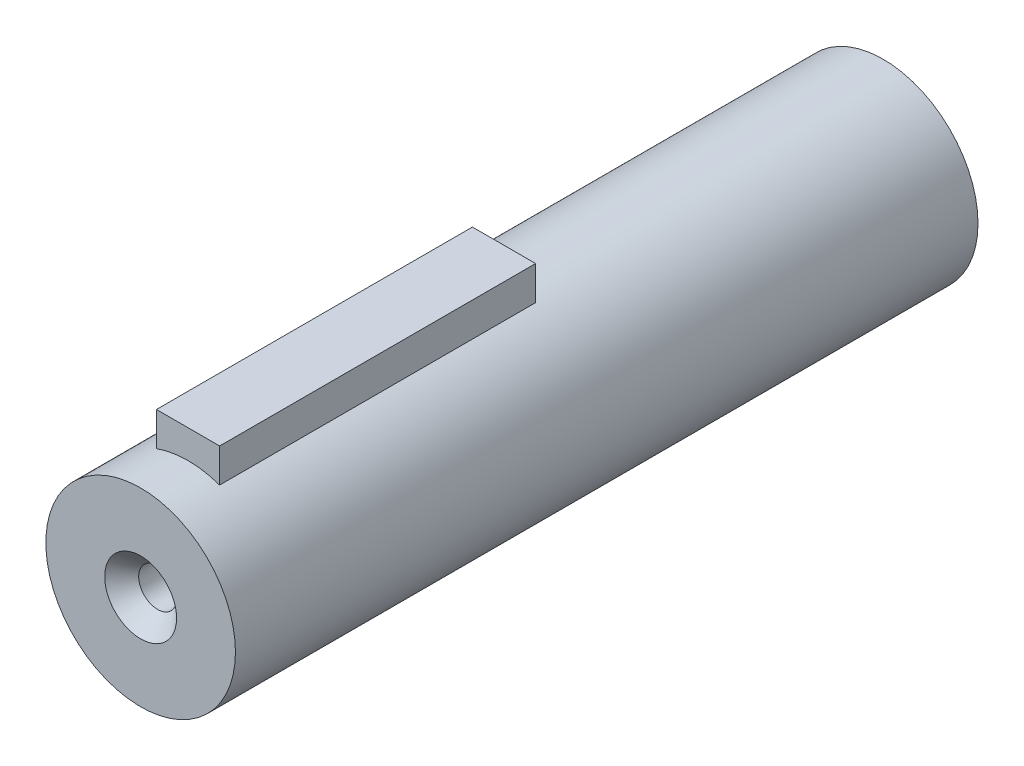
from build123d import *

# Parameters (mm, degrees)
SKETCH_1_R                   = 6
EXTRUDE_1_DEPTH              = 47
EXTRUDE_2_DEPTH              = 1.8
EXTRUDE_2_DEPTH_BACK         = 1.8
SKETCH_2_W                   = 20
SKETCH_2_H                   = 4
HOLE_WIZARD_M2_2_D           = 2.4
HOLE_WIZARD_M2_2_DEPTH       = 5
HOLE_WIZARD_M2_2_CSINK_D     = 4.55
HOLE_WIZARD_M2_2_CSINK_ANGLE = 90
HOLE_WIZARD_M2_2_TIP         = 0.721032743
HOLE_WIZARD_M2_3_D           = 2.4
HOLE_WIZARD_M2_3_DEPTH       = 5
HOLE_WIZARD_M2_3_CSINK_D     = 4.55
HOLE_WIZARD_M2_3_CSINK_ANGLE = 90
HOLE_WIZARD_M2_3_TIP         = 0.721032743


with BuildPart() as part:
    # 스케치1 → 보스-돌출1 (new body)
    with BuildSketch(Plane.XY):
        Circle(SKETCH_1_R)
    extrude(amount=EXTRUDE_1_DEPTH)

    # 스케치2 → 보스-돌출2 (add, two sides: drawn at the far end of the back side and taken through both)
    with BuildSketch(Plane(origin=(0, 6, 0), x_dir=(0, 0, -1), z_dir=(0, 1, 0)).offset(-EXTRUDE_2_DEPTH_BACK)):
        with Locations((-34, 0)):
            Rectangle(SKETCH_2_W, SKETCH_2_H)
    extrude(amount=EXTRUDE_2_DEPTH + EXTRUDE_2_DEPTH_BACK)

    # M2 여유 구멍2
    with Locations(Plane.XY.offset(47)):
        with Locations((0, 0)):
            CounterSinkHole(HOLE_WIZARD_M2_2_D / 2, HOLE_WIZARD_M2_2_CSINK_D / 2, depth=HOLE_WIZARD_M2_2_DEPTH, counter_sink_angle=HOLE_WIZARD_M2_2_CSINK_ANGLE)
            with Locations((0, 0, -(HOLE_WIZARD_M2_2_DEPTH + HOLE_WIZARD_M2_2_TIP / 2))):  # 118° drill point
                Cone(0, HOLE_WIZARD_M2_2_D / 2, HOLE_WIZARD_M2_2_TIP, mode=Mode.SUBTRACT)

    # M2 여유 구멍3
    with Locations(Plane(origin=(0, 0, 0), x_dir=(-1, 0, 0), z_dir=(0, 0, -1))):
        with Locations((0, 0)):
            CounterSinkHole(HOLE_WIZARD_M2_3_D / 2, HOLE_WIZARD_M2_3_CSINK_D / 2, depth=HOLE_WIZARD_M2_3_DEPTH, counter_sink_angle=HOLE_WIZARD_M2_3_CSINK_ANGLE)
            with Locations((0, 0, -(HOLE_WIZARD_M2_3_DEPTH + HOLE_WIZARD_M2_3_TIP / 2))):  # 118° drill point
                Cone(0, HOLE_WIZARD_M2_3_D / 2, HOLE_WIZARD_M2_3_TIP, mode=Mode.SUBTRACT)


solid = part.part
